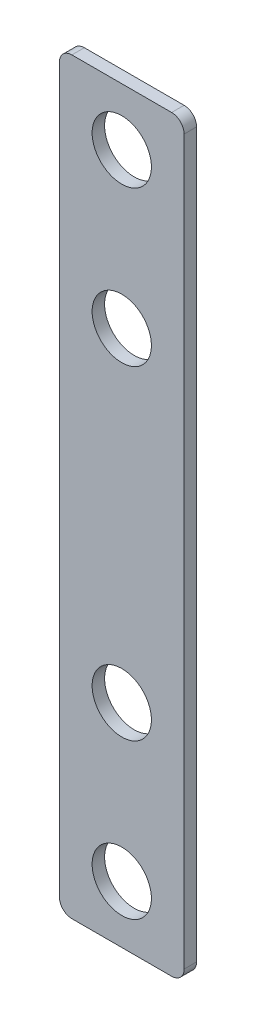
from build123d import *

# Parameters (mm, degrees)
SKETCH1_W                                = 50
SKETCH1_H                                = 300
BOSS_EXTRUDE1_DEPTH                      = 5
FILLET3_R                                = 5
CBORE_FOR_M12_HEX_HEAD_BOLT1_D           = 13.5
CBORE_FOR_M12_HEX_HEAD_BOLT1_CBORE_D     = 23.785
CBORE_FOR_M12_HEX_HEAD_BOLT1_CBORE_DEPTH = 7.5


with BuildPart() as part:
    # Sketch1 → Boss-Extrude1 (new body)
    with BuildSketch(Plane.XY):
        Rectangle(SKETCH1_W, SKETCH1_H)
    extrude(amount=BOSS_EXTRUDE1_DEPTH)

    # Fillet3
    fillet3_edges = [part.edges().sort_by_distance(p)[0] for p in [
        (-25, 150, 2.5),
        (25, 150, 2.5),
        (25, -150, 2.5),
        (-25, -150, 2.5),
    ]]
    fillet(fillet3_edges, radius=FILLET3_R)

    # CBORE for M12 Hex Head Bolt1 (through all)
    with Locations(Plane.XY.offset(5)):
        with Locations((0, 127), (0, 65), (0, -65), (0, -127)):
            CounterBoreHole(CBORE_FOR_M12_HEX_HEAD_BOLT1_D / 2, CBORE_FOR_M12_HEX_HEAD_BOLT1_CBORE_D / 2, CBORE_FOR_M12_HEX_HEAD_BOLT1_CBORE_DEPTH)


solid = part.part
